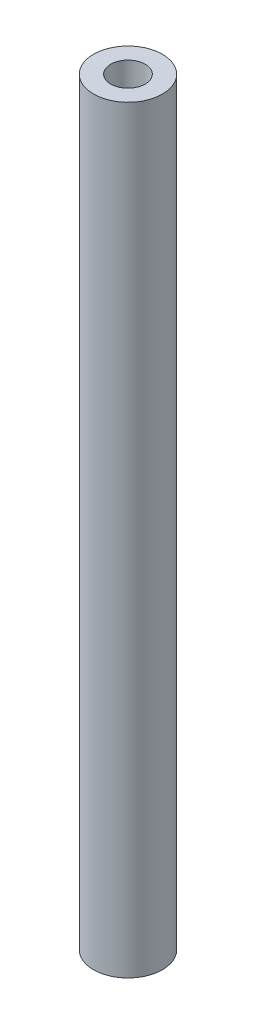
from build123d import *

# Parameters (mm, degrees)
SKETCH1_R                  = 2.5
BOSS_EXTRUDE2_DEPTH        = 55
F_2_5_2_5_DIAMETER_HOLE1_D = 2.5


with BuildPart() as part:
    # Sketch1 → Boss-Extrude2 (new body)
    with BuildSketch(Plane(origin=(0, 0, 0), x_dir=(1, 0, 0), z_dir=(0, 1, 0))):
        with Locations(Location((-58.188217949, -19.350235378, 0), (0, 0, 270))):
            Circle(SKETCH1_R)
    extrude(amount=BOSS_EXTRUDE2_DEPTH)

    # Ø2.5 (2.5) Diameter Hole1 (through all)
    with Locations(Plane(origin=(0, 55, 0), x_dir=(1, 0, 0), z_dir=(0, 1, 0))):
        with Locations((-58.188217949, -19.350235378)):
            Hole(F_2_5_2_5_DIAMETER_HOLE1_D / 2)


solid = part.part
